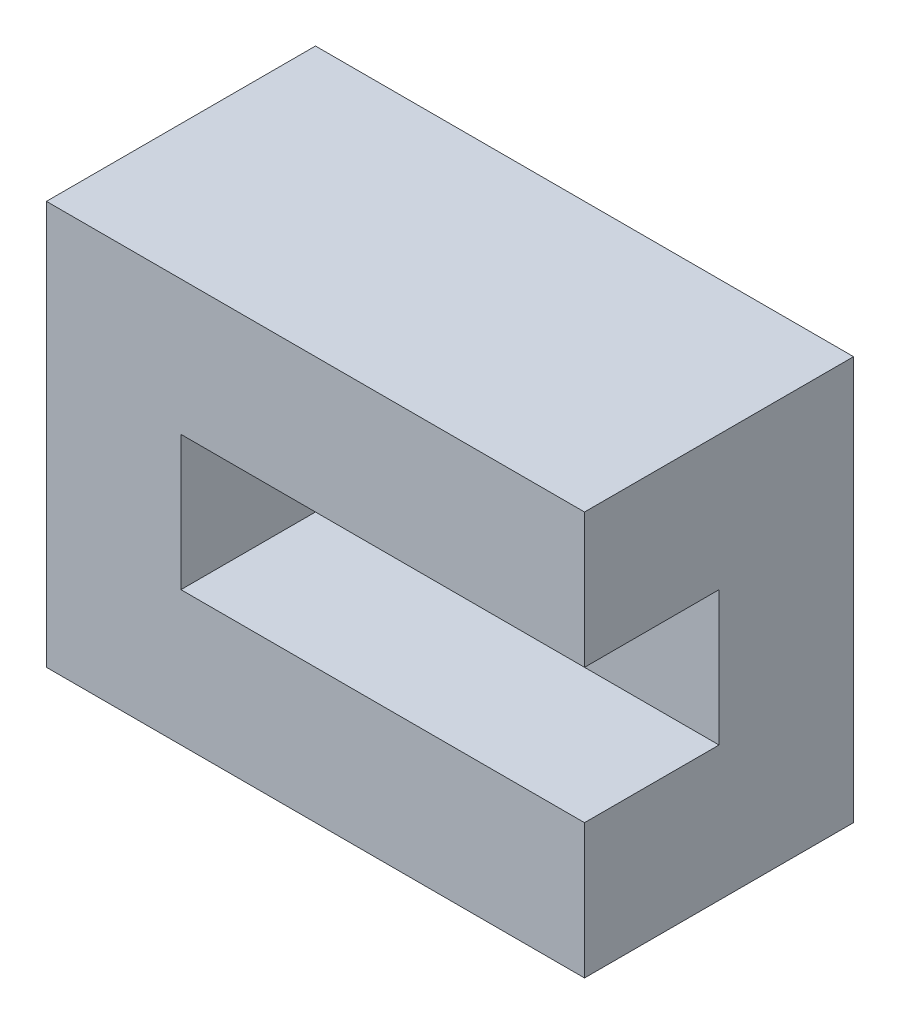
from build123d import *

# Parameters (mm, degrees)
SKETCH_1_W      = 20
SKETCH_1_H      = 15
EXTRUDE_1_DEPTH = 5
EXTRUDE_2_DEPTH = 5


with BuildPart() as part:
    # 草图1 → 凸台-拉伸1 (new body)
    with BuildSketch(Plane.XY):
        with Locations((-4.771573604, 7.043147208)):
            Rectangle(SKETCH_1_W, SKETCH_1_H)
    extrude(amount=EXTRUDE_1_DEPTH)

    # 草图4 → 凸台-拉伸2 (add)
    with BuildSketch(Plane.XY.offset(5)):
        Polygon((-14.771573604, -0.456852792), (5.228426396, -0.456852792), (5.228426396, 4.543147208), (-9.771573604, 4.543147208), (-9.771573604, 9.543147208), (5.228426396, 9.543147208), (5.228426396, 14.543147208), (-14.771573604, 14.543147208), align=None)
    extrude(amount=EXTRUDE_2_DEPTH)


solid = part.part
